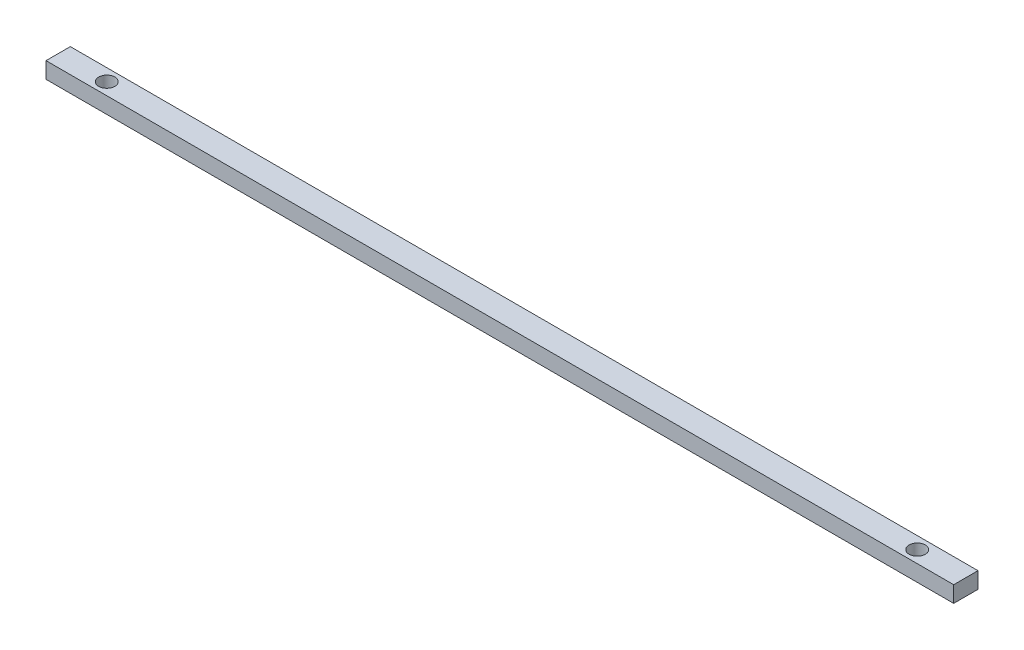
from build123d import *

# Parameters (mm, degrees)
SKETCH2_W           = 15
SKETCH2_H           = 10
BOSS_EXTRUDE1_DEPTH = 560
SKETCH3_R           = 5
CUT_EXTRUDE1_DEPTH  = 10


with BuildPart() as part:
    # Sketch2 → Boss-Extrude1 (new body)
    with BuildSketch(Plane(origin=(0, 0, 0), x_dir=(0, 0, -1), z_dir=(1, 0, 0))):
        Rectangle(SKETCH2_W, SKETCH2_H)
    extrude(amount=BOSS_EXTRUDE1_DEPTH)

    # Sketch3 → Cut-Extrude1 (cut)
    with BuildSketch(Plane(origin=(0, 5, 0), x_dir=(1, 0, 0), z_dir=(0, 1, 0))):
        with Locations(Location((30, 0, 0), (0, 0, 270))):
            Circle(SKETCH3_R)
        with Locations(Location((530, 0, 0), (0, 0, 270))):
            Circle(SKETCH3_R)
    extrude(amount=-CUT_EXTRUDE1_DEPTH, mode=Mode.SUBTRACT)


solid = part.part
